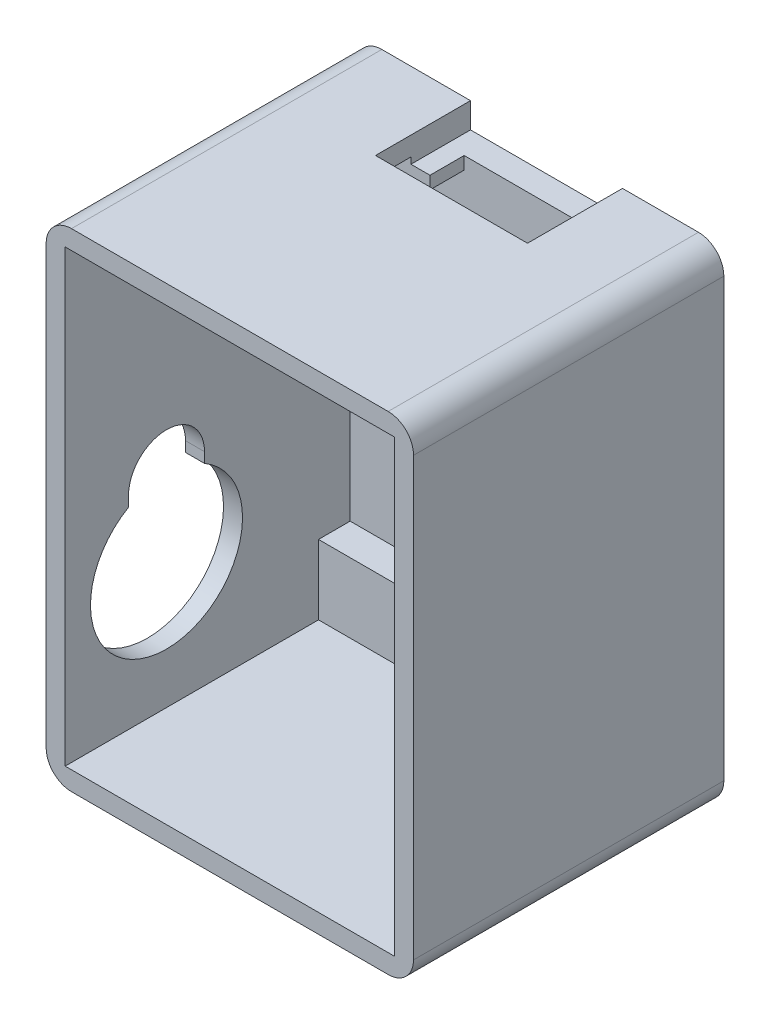
from build123d import *

# Parameters (mm, degrees)
SKETCH_1_W               = 29
SKETCH_1_H               = 38.5
EXTRUDE_1_DEPTH          = 24
SHELL_1_T                = -1.5
SKETCH_7_W               = 26
SKETCH_7_H               = 5.5
EXTRUDE_7_DEPTH          = 2.5
SKETCH_5_W               = 2.7
SKETCH_5_H               = 1.5
EXTRUDE_8_DEPTH          = 8
SKETCH_6_W               = 2.7
SKETCH_6_H               = 1.5
EXTRUDE_9_DEPTH          = 9
CUT_EXTRUDE_7_DEPTH      = 1.5
SKETCH_9_W               = 29
SKETCH_9_H               = 38.5
EXTRUDE_10_DEPTH         = 0.5
FILLET_3_R               = 2
CUT_EXTRUDE_8_DEPTH      = 1.5
CUT_EXTRUDE_8_DEPTH_BACK = 7
SKETCH_2_W               = 12
SKETCH_2_H               = 2


with BuildPart() as part:
    # 草图1 → 凸台-拉伸1 (new body)
    with BuildSketch(Plane.XY):
        with Locations((14.5, -19.25)):
            Rectangle(SKETCH_1_W, SKETCH_1_H)
    extrude(amount=EXTRUDE_1_DEPTH)

    # 抽壳1
    shell_1_openings = [part.faces().sort_by_distance(p)[0] for p in [
        (14.5, -19.25, 24),
    ]]
    offset(amount=SHELL_1_T, openings=shell_1_openings, kind=Kind.INTERSECTION)

    # 草图7 → 凸台-拉伸7 (add)
    with BuildSketch(Plane.XY.offset(1.5)):
        with Locations((14.5, -34.25)):
            Rectangle(SKETCH_7_W, SKETCH_7_H)
    extrude(amount=EXTRUDE_7_DEPTH)

    # 草图5 → 凸台-拉伸8 (add)
    with BuildSketch(Plane.ZY.offset(-27.5)):
        with Locations((2.85, -2.25)):
            Rectangle(SKETCH_5_W, SKETCH_5_H)
    extrude(amount=EXTRUDE_8_DEPTH)

    # 草图6 → 凸台-拉伸9 (add)
    with BuildSketch(Plane(origin=(1.5, 0, 0), x_dir=(0, 0, -1), z_dir=(1, 0, 0))):
        with Locations((-2.85, -2.25)):
            Rectangle(SKETCH_6_W, SKETCH_6_H)
    extrude(amount=EXTRUDE_9_DEPTH)

    # 草图8 → 切除-拉伸7 (cut)
    with BuildSketch(Plane.ZY):
        with BuildLine():
            Line((19, -21), (19, -21.803847577))
            ThreePointArc((19, -21.803847577), (16, -33), (13, -21.803847577))
            Line((13, -21.803847577), (13, -21))
            ThreePointArc((13, -21), (16, -18), (19, -21))
        make_face()
    extrude(amount=-CUT_EXTRUDE_7_DEPTH, mode=Mode.SUBTRACT)

    # 草图9 → 凸台-拉伸10 (add)
    with BuildSketch(Plane(origin=(0, 0, 0), x_dir=(-1, 0, 0), z_dir=(0, 0, -1))):
        with Locations((-14.5, -19.25)):
            Rectangle(SKETCH_9_W, SKETCH_9_H)
    extrude(amount=EXTRUDE_10_DEPTH)

    # 圆角3
    fillet_3_edges = [part.edges().sort_by_distance(p)[0] for p in [
        (0, 0, 11.75),
        (29, 0, 11.75),
        (29, -38.5, 11.75),
        (0, -38.5, 11.75),
    ]]
    fillet(fillet_3_edges, radius=FILLET_3_R)

    # 草图2 → 切除-拉伸8 (cut, two sides: drawn at the far end of the back side and taken through both)
    with BuildSketch(Plane(origin=(0, 0, 0), x_dir=(-1, 0, 0), z_dir=(0, 0, -1)).offset(-CUT_EXTRUDE_8_DEPTH_BACK)):
        with Locations((-15, -1)):
            Rectangle(SKETCH_2_W, SKETCH_2_H)
    extrude(amount=CUT_EXTRUDE_8_DEPTH + CUT_EXTRUDE_8_DEPTH_BACK, mode=Mode.SUBTRACT)


solid = part.part
